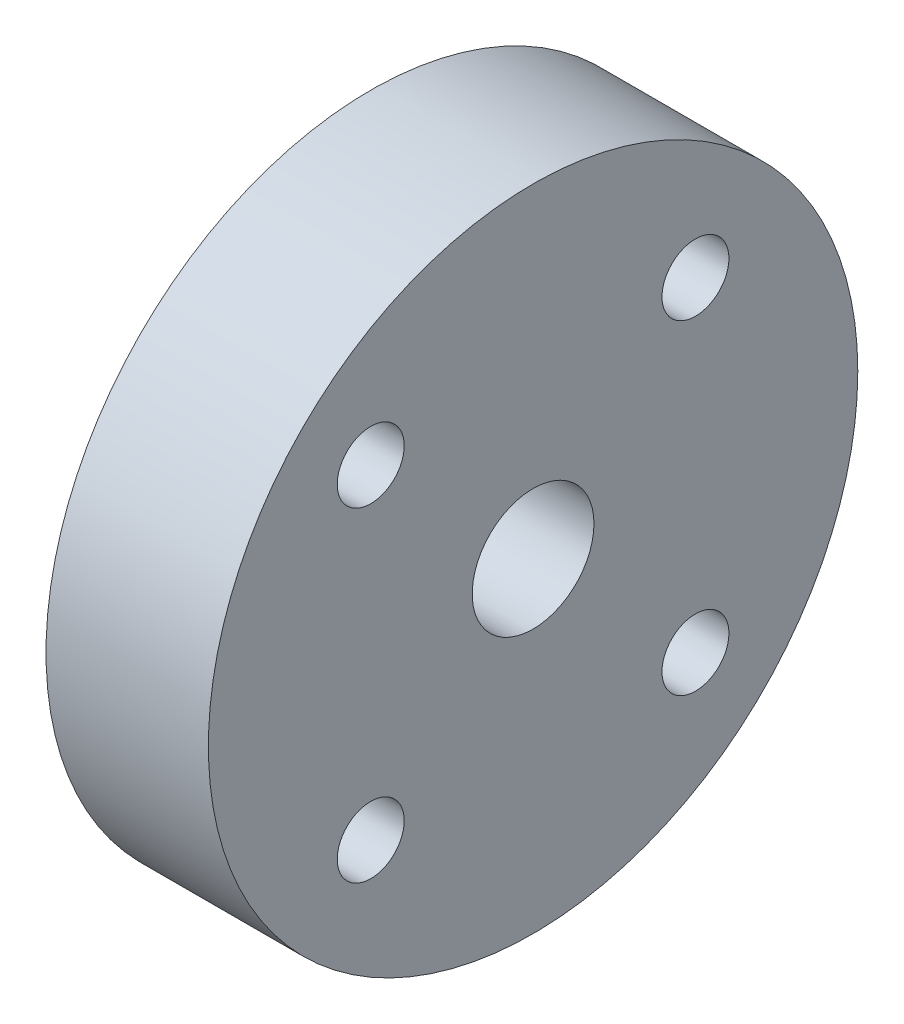
from build123d import *

# Parameters (mm, degrees)
SK_BODY_R                = 16
EX_BODY_DEPTH            = 8
SK_BORE_R                = 3
CUT_BORE_DEPTH           = 8
SK_PATTERN16_4XM4_R      = 1.65
CUT_PATTERN16_4XM4_DEPTH = 6


with BuildPart() as part:
    # SK_Body → EX_Body (new body)
    with BuildSketch(Plane(origin=(0, 0, 0), x_dir=(0, 0, -1), z_dir=(1, 0, 0))):
        Circle(SK_BODY_R)
    extrude(amount=EX_BODY_DEPTH)

    # SK_Bore → CUT_Bore (cut)
    with BuildSketch(Plane(origin=(0, 0, 0), x_dir=(0, 0, -1), z_dir=(1, 0, 0))):
        Circle(SK_BORE_R)
    extrude(amount=CUT_BORE_DEPTH, mode=Mode.SUBTRACT)

    # SK_Pattern16_4xM4 → CUT_Pattern16_4xM4 (cut)
    with BuildSketch(Plane(origin=(8, 0, 0), x_dir=(0, 0, -1), z_dir=(1, 0, 0))):
        with Locations((-8, 8)):
            Circle(SK_PATTERN16_4XM4_R)
        with Locations((-8, -8)):
            Circle(SK_PATTERN16_4XM4_R)
        with Locations((8, 8)):
            Circle(SK_PATTERN16_4XM4_R)
        with Locations((8, -8)):
            Circle(SK_PATTERN16_4XM4_R)
    extrude(amount=-CUT_PATTERN16_4XM4_DEPTH, mode=Mode.SUBTRACT)


solid = part.part
